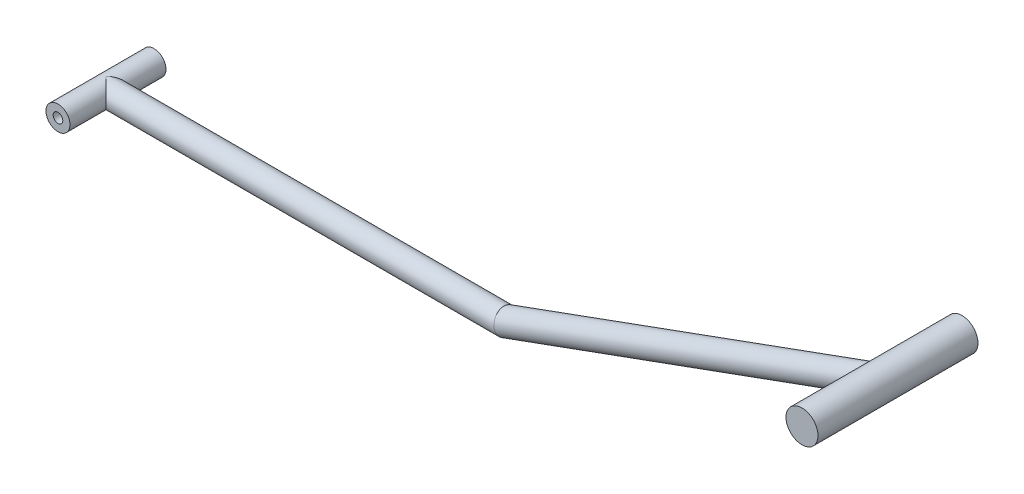
from build123d import *

# Parameters (mm, degrees)
SKETCH1_R           = 15
SKETCH1_R_2         = 6
BOSS_EXTRUDE1_DEPTH = 60
SKETCH2_R           = 15
SKETCH5_R           = 20
BOSS_EXTRUDE2_DEPTH = 100


with BuildPart() as part:
    # Sketch1 → Boss-Extrude1 (new, symmetric)
    with BuildSketch(Plane.XY):
        Circle(SKETCH1_R)
        Circle(SKETCH1_R_2, mode=Mode.SUBTRACT)
    extrude(amount=BOSS_EXTRUDE1_DEPTH, both=True)

    # Sweep1: sweep along a path in Sketch3
    with BuildLine(Plane.XY) as sweep1_path:
        Line((0, 0), (500, 0))
        Line((500, 0), (969.846310393, 171.010071663))
    # Sketch2 → Sweep1 (sweep)
    with BuildSketch(Plane(origin=(0, 0, 0), x_dir=(0, 0, -1), z_dir=(1, 0, 0))):
        Circle(SKETCH2_R)
    sweep(path=sweep1_path.line, transition=Transition.RIGHT)

    # Sketch5 → Boss-Extrude2 (add, symmetric)
    with BuildSketch(Plane.XY):
        with Locations((969.846310393, 171.010071663)):
            Circle(SKETCH5_R)
    extrude(amount=BOSS_EXTRUDE2_DEPTH, both=True)


solid = part.part
